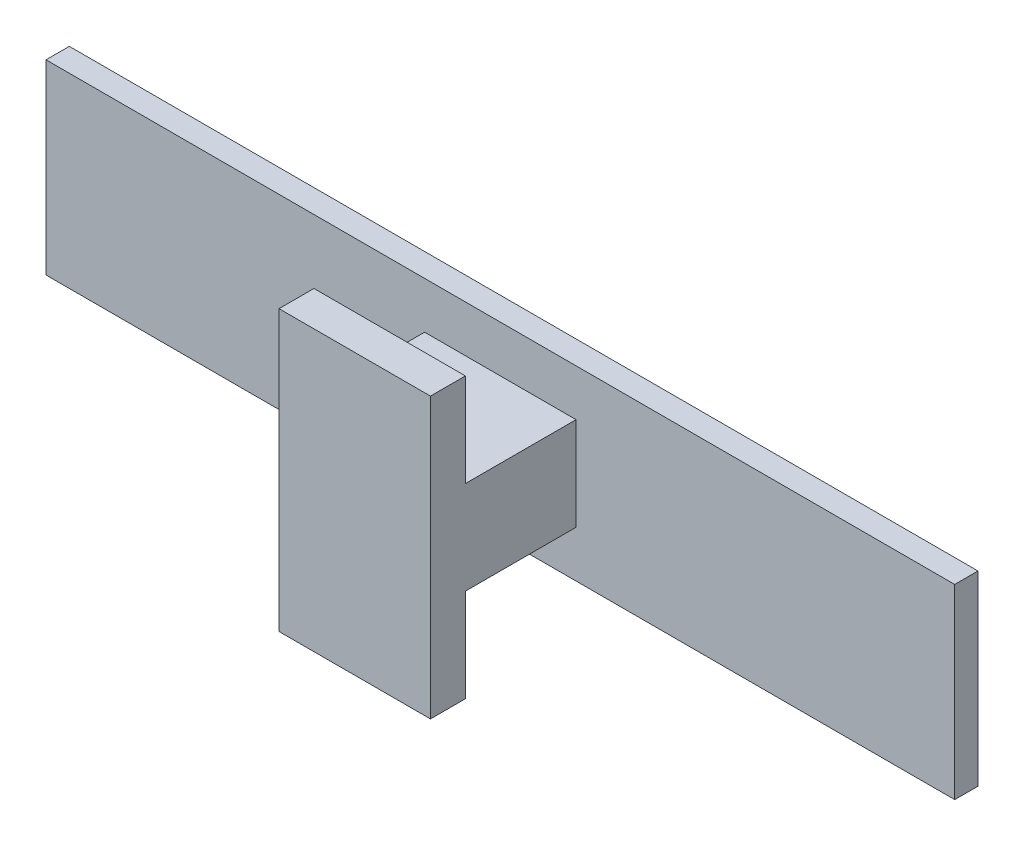
from build123d import *

# Parameters (mm, degrees)
SKETCH1_W           = 78
SKETCH1_H           = 16
BOSS_EXTRUDE1_DEPTH = 2
SKETCH2_W           = 13
SKETCH2_H           = 8
BOSS_EXTRUDE2_DEPTH = 9.5
SKETCH3_W           = 13
SKETCH3_H           = 24
BOSS_EXTRUDE3_DEPTH = 3


with BuildPart() as part:
    # Sketch1 → Boss-Extrude1 (new body)
    with BuildSketch(Plane.XY):
        Rectangle(SKETCH1_W, SKETCH1_H)
    extrude(amount=BOSS_EXTRUDE1_DEPTH)

    # Sketch2 → Boss-Extrude2 (add)
    with BuildSketch(Plane.XY.offset(2)):
        Rectangle(SKETCH2_W, SKETCH2_H)
    extrude(amount=BOSS_EXTRUDE2_DEPTH)

    # Sketch3 → Boss-Extrude3 (add)
    with BuildSketch(Plane.XY.offset(11.5)):
        Rectangle(SKETCH3_W, SKETCH3_H)
    extrude(amount=BOSS_EXTRUDE3_DEPTH)


solid = part.part
